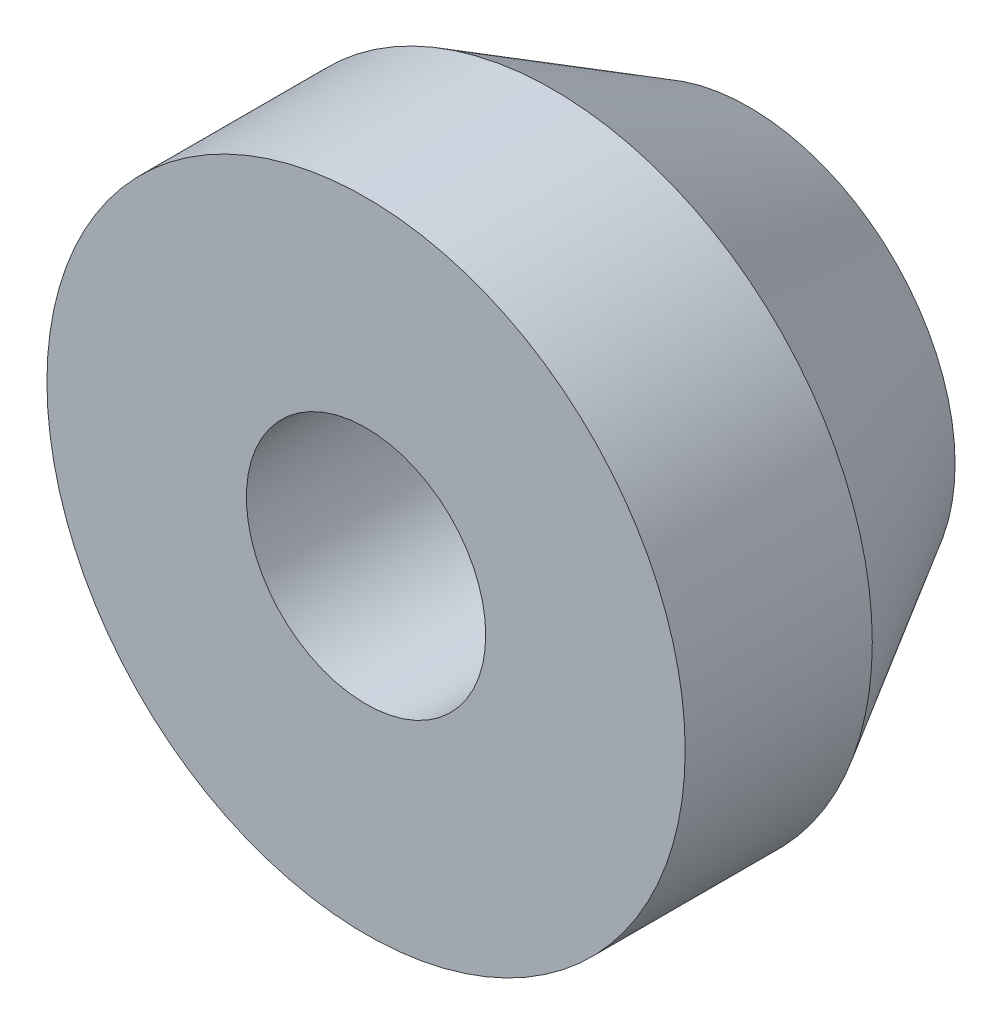
from build123d import *

# Parameters (mm, degrees)
SKETCH1_W      = 7.9375
SKETCH1_H      = 15.24
CHAMFER1_SIZE  = 4.5
CHAMFER1_SIZE2 = 7.794228634


with BuildPart() as part:
    # Sketch1 → Revolve1 (revolve)
    with BuildSketch(Plane(origin=(0, 0, 0), x_dir=(1, 0, 0), z_dir=(0, 1, 0)), mode=Mode.PRIVATE) as revolve1_sk:
        with Locations((-8.73125, 7.62)):
            Rectangle(SKETCH1_W, SKETCH1_H)
    revolve(revolve1_sk.sketch.rotate(Axis((0, 0, 0), (0, 0, -1)), 180), axis=Axis((0, 0, 0), (0, 0, -1)))

    # Chamfer1
    chamfer1_edges = [part.edges().sort_by_distance(p)[0] for p in [
        (-12.7, 0, -15.24),
    ]]
    chamfer1_side = [part.faces().sort_by_distance(p)[0] for p in [
        (-5.121710245, 0, -15.24),
    ]]
    chamfer(chamfer1_edges, length=CHAMFER1_SIZE, length2=CHAMFER1_SIZE2, reference=chamfer1_side[0])


solid = part.part
